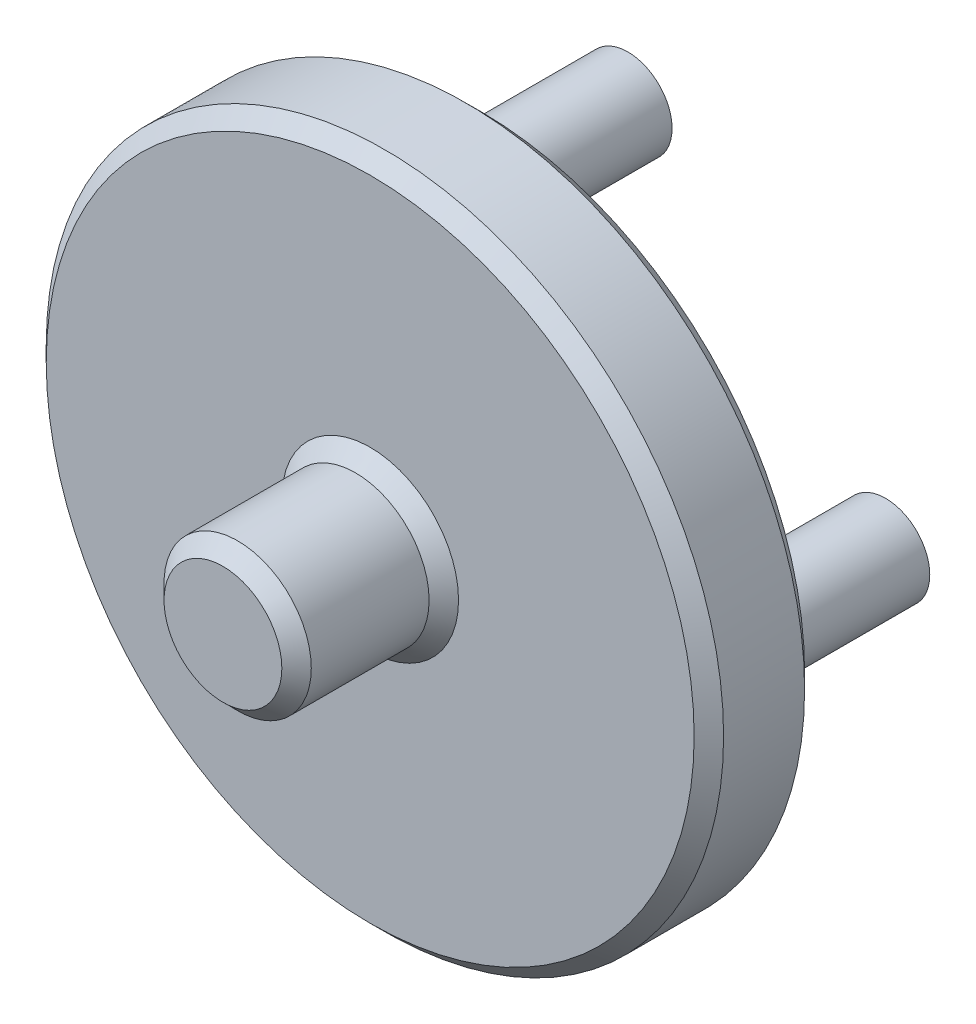
from build123d import *

# Parameters (mm, degrees)
SKETCH1_R           = 23
BOSS_EXTRUDE1_DEPTH = 7.5
SKETCH2_R           = 3
BOSS_EXTRUDE2_DEPTH = 10
SKETCH3_R           = 5
BOSS_EXTRUDE3_DEPTH = 10
CHAMFER1_SIZE       = 1


with BuildPart() as part:
    # Sketch1 → Boss-Extrude1 (new body)
    with BuildSketch(Plane.XY):
        Circle(SKETCH1_R)
    extrude(amount=BOSS_EXTRUDE1_DEPTH)

    # Sketch2 → Boss-Extrude2 (add)
    with BuildSketch(Plane.XY):
        with Locations((0, 17.5)):
            Circle(SKETCH2_R)
        with Locations((17.5, 0)):
            Circle(SKETCH2_R)
        with Locations((0, -17.5)):
            Circle(SKETCH2_R)
        with Locations((-17.5, 0)):
            Circle(SKETCH2_R)
    extrude(amount=-BOSS_EXTRUDE2_DEPTH)

    # Sketch3 → Boss-Extrude3 (add)
    with BuildSketch(Plane.XY.offset(7.5)):
        Circle(SKETCH3_R)
    extrude(amount=BOSS_EXTRUDE3_DEPTH)

    # Chamfer1
    chamfer1_edges = [part.edges().sort_by_distance(p)[0] for p in [
        (14.5, 0, 0),
        (-3, -17.5, 0),
        (-20.5, 0, 0),
        (-23, 0, 0),
        (-5, 0, 7.5),
        (-5, 0, 17.5),
        (-23, 0, 7.5),
        (-3, 17.5, 0),
    ]]
    chamfer(chamfer1_edges, length=CHAMFER1_SIZE)


solid = part.part
